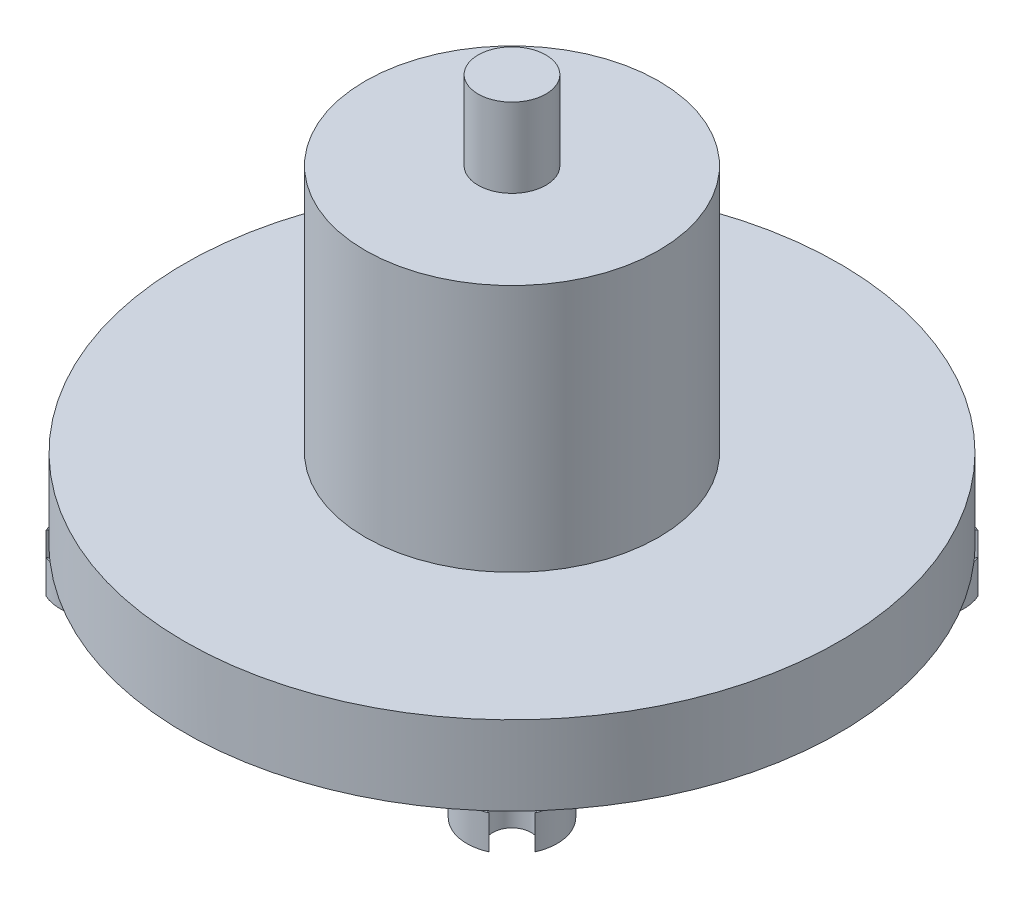
from build123d import *

# Parameters (mm, degrees)
SKETCH1_R           = 58
BOSS_EXTRUDE1_DEPTH = 14
SKETCH2_R           = 8
BOSS_EXTRUDE2_DEPTH = 6
SKETCH3_R           = 26
BOSS_EXTRUDE3_DEPTH = 58
SKETCH4_R           = 6
BOSS_EXTRUDE4_DEPTH = 72
SKETCH5_R           = 3.4
CUT_EXTRUDE1_DEPTH  = 110.142109197


with BuildPart() as part:
    # Sketch1 → Boss-Extrude1 (new body)
    with BuildSketch(Plane(origin=(0, 0, 0), x_dir=(1, 0, 0), z_dir=(0, 1, 0))):
        with Locations(Location((0, 0, 0), (0, 0, 270))):
            Circle(SKETCH1_R)
    extrude(amount=BOSS_EXTRUDE1_DEPTH)

    # Sketch2 → Boss-Extrude2 (add)
    with BuildSketch(Plane(origin=(0, 0, 0), x_dir=(1, 0, 0), z_dir=(0, 1, 0))):
        with Locations(Location((-36, -36, 0), (0, 0, 270))):
            Circle(SKETCH2_R)
        with Locations(Location((36, -36, 0), (0, 0, 270))):
            Circle(SKETCH2_R)
        with Locations(Location((-36, 36, 0), (0, 0, 270))):
            Circle(SKETCH2_R)
        with Locations(Location((36, 36, 0), (0, 0, 270))):
            Circle(SKETCH2_R)
    extrude(amount=-BOSS_EXTRUDE2_DEPTH)

    # Sketch3 → Boss-Extrude3 (add)
    with BuildSketch(Plane(origin=(0, 0, 0), x_dir=(1, 0, 0), z_dir=(0, 1, 0))):
        with Locations(Location((0, 0, 0), (0, 0, 90))):
            Circle(SKETCH3_R)
    extrude(amount=BOSS_EXTRUDE3_DEPTH)

    # Sketch4 → Boss-Extrude4 (add)
    with BuildSketch(Plane(origin=(0, 0, 0), x_dir=(1, 0, 0), z_dir=(0, 1, 0))):
        with Locations(Location((0, 0, 0), (0, 0, 270))):
            Circle(SKETCH4_R)
    extrude(amount=BOSS_EXTRUDE4_DEPTH)

    # Sketch5 → Cut-Extrude1 (cut, through all)
    with BuildSketch(Plane(origin=(0, 0, 0), x_dir=(1, 0, 0), z_dir=(0, 1, 0))):
        with Locations((-40, -40)):
            Circle(SKETCH5_R)
        with Locations((40, -40)):
            Circle(SKETCH5_R)
        with Locations((-40, 40)):
            Circle(SKETCH5_R)
        with Locations((40, 40)):
            Circle(SKETCH5_R)
    extrude(amount=-CUT_EXTRUDE1_DEPTH, mode=Mode.SUBTRACT)


solid = part.part
